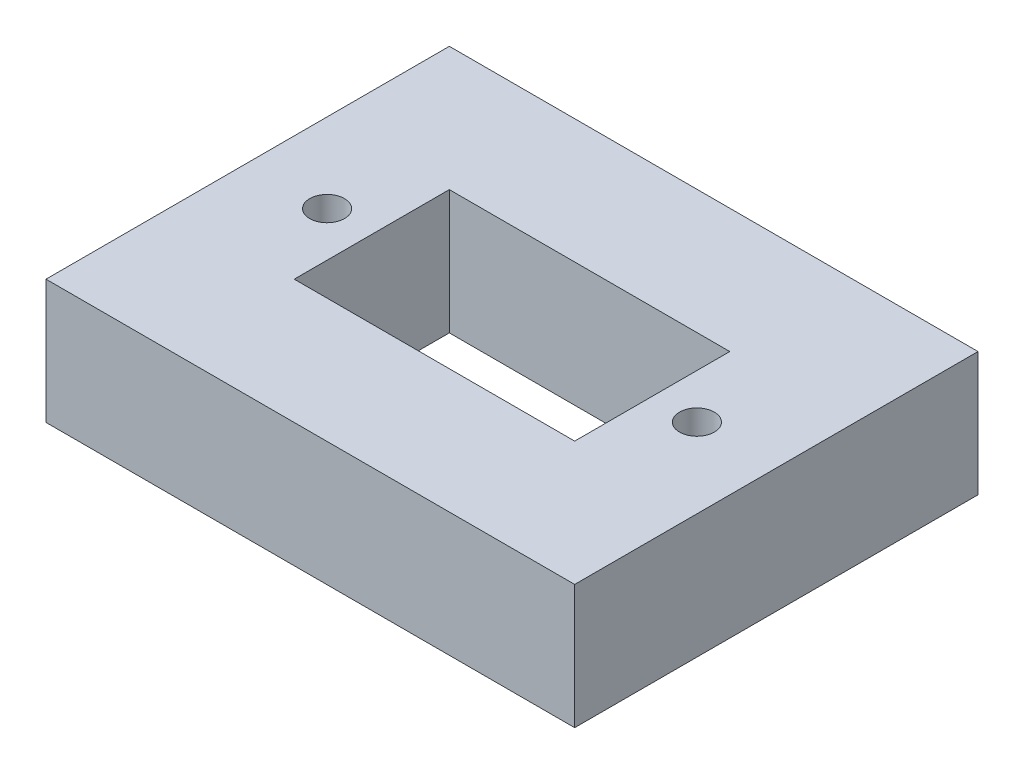
from build123d import *

# Parameters (mm, degrees)
SKETCH1_W           = 42.6
SKETCH1_H           = 32.5
SKETCH1_R           = 1.4
SKETCH1_W_2         = 22.6
SKETCH1_H_2         = 12.5
BOSS_EXTRUDE1_DEPTH = 10


with BuildPart() as part:
    # Sketch1 → Boss-Extrude1 (new body)
    with BuildSketch(Plane(origin=(0, 0, 0), x_dir=(1, 0, 0), z_dir=(0, 1, 0))):
        Rectangle(SKETCH1_W, SKETCH1_H)
        with Locations(Location((-14.9, 0, 0), (0, 0, 270))):
            Circle(SKETCH1_R, mode=Mode.SUBTRACT)
        with Locations(Location((14.9, 0, 0), (0, 0, 90))):
            Circle(SKETCH1_R, mode=Mode.SUBTRACT)
        Rectangle(SKETCH1_W_2, SKETCH1_H_2, mode=Mode.SUBTRACT)
    extrude(amount=BOSS_EXTRUDE1_DEPTH)


solid = part.part
